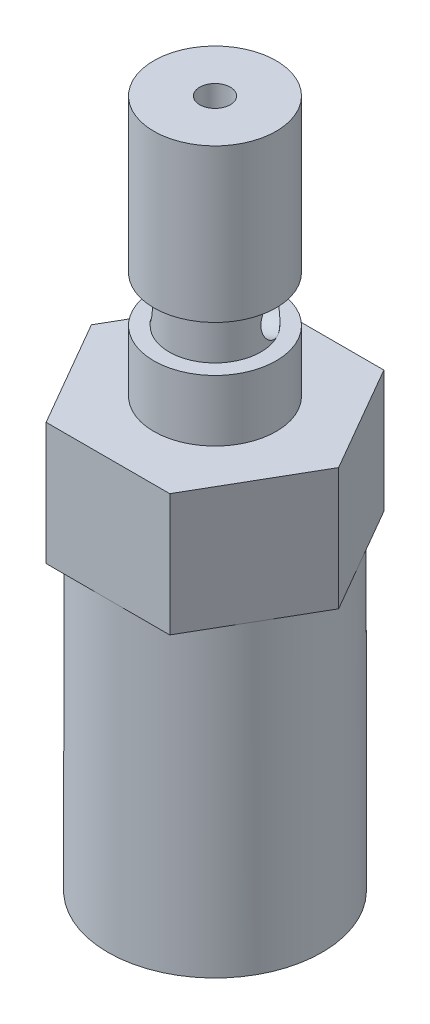
from build123d import *

# Parameters (mm, degrees)
SKETCH1_R           = 3.5
BOSS_EXTRUDE1_DEPTH = 10
BOSS_EXTRUDE2_DEPTH = 4
SKETCH3_R           = 2
BOSS_EXTRUDE3_DEPTH = 2
SKETCH4_R           = 1.5
BOSS_EXTRUDE4_DEPTH = 1.5
SKETCH5_R           = 2
BOSS_EXTRUDE5_DEPTH = 5
SKETCH6_R           = 0.75
CUT_EXTRUDE1_DEPTH  = 5
SKETCH7_R           = 2.5
CUT_EXTRUDE2_DEPTH  = 8
SKETCH8_R           = 1.5
CUT_EXTRUDE4_DEPTH  = 5
SKETCH9_R           = 0.5
CUT_EXTRUDE5_DEPTH  = 15.056433877


with BuildPart() as part:
    # Sketch1 → Boss-Extrude1 (new body)
    with BuildSketch(Plane(origin=(0, 0, 0), x_dir=(1, 0, 0), z_dir=(0, 1, 0))):
        with Locations(Location((0, 0, 0), (0, 0, 270))):
            Circle(SKETCH1_R)
    extrude(amount=BOSS_EXTRUDE1_DEPTH)

    # Sketch2 → Boss-Extrude2 (add)
    with BuildSketch(Plane(origin=(0, 10, 0), x_dir=(1, 0, 0), z_dir=(0, 1, 0))):
        Polygon((2.020725942, 3.5), (-2.020725942, 3.5), (-4.041451884, 0), (-2.020725942, -3.5), (2.020725942, -3.5), (4.041451884, 0), align=None)
    extrude(amount=BOSS_EXTRUDE2_DEPTH)

    # Sketch3 → Boss-Extrude3 (add)
    with BuildSketch(Plane(origin=(0, 14, 0), x_dir=(1, 0, 0), z_dir=(0, 1, 0))):
        with Locations(Location((0, 0, 0), (0, 0, 270))):
            Circle(SKETCH3_R)
    extrude(amount=BOSS_EXTRUDE3_DEPTH)

    # Sketch4 → Boss-Extrude4 (add)
    with BuildSketch(Plane(origin=(0, 16, 0), x_dir=(1, 0, 0), z_dir=(0, 1, 0))):
        with Locations(Location((0, 0, 0), (0, 0, 270))):
            Circle(SKETCH4_R)
    extrude(amount=BOSS_EXTRUDE4_DEPTH)

    # Sketch5 → Boss-Extrude5 (add)
    with BuildSketch(Plane(origin=(0, 17.5, 0), x_dir=(1, 0, 0), z_dir=(0, 1, 0))):
        with Locations(Location((0, 0, 0), (0, 0, 270))):
            Circle(SKETCH5_R)
    extrude(amount=BOSS_EXTRUDE5_DEPTH)

    # Sketch6 → Cut-Extrude1 (cut)
    with BuildSketch(Plane(origin=(-1.299038106, 0, 0.75), x_dir=(0.5000000000000026, 0, 0.8660254037844373), z_dir=(-0.8660254037844373, 0, 0.5000000000000026))):
        with Locations(Location((0, 16.75, 0), (0, 0, 90))):
            Circle(SKETCH6_R)
    extrude(amount=-CUT_EXTRUDE1_DEPTH, mode=Mode.SUBTRACT)

    # Sketch7 → Cut-Extrude2 (cut)
    with BuildSketch(Plane.XZ):
        with Locations(Location((0, 0, 0), (0, 0, 270))):
            Circle(SKETCH7_R)
    extrude(amount=-CUT_EXTRUDE2_DEPTH, mode=Mode.SUBTRACT)

    # Sketch8 → Cut-Extrude4 (cut)
    with BuildSketch(Plane.XZ.offset(-8)):
        with Locations(Location((0, 0, 0), (0, 0, 270))):
            Circle(SKETCH8_R)
    extrude(amount=-CUT_EXTRUDE4_DEPTH, mode=Mode.SUBTRACT)

    # Sketch9 → Cut-Extrude5 (cut, through all)
    with BuildSketch(Plane.XZ.offset(-13)):
        with Locations(Location((0, 0, 0), (0, 0, 270))):
            Circle(SKETCH9_R)
    extrude(amount=-CUT_EXTRUDE5_DEPTH, mode=Mode.SUBTRACT)


solid = part.part
